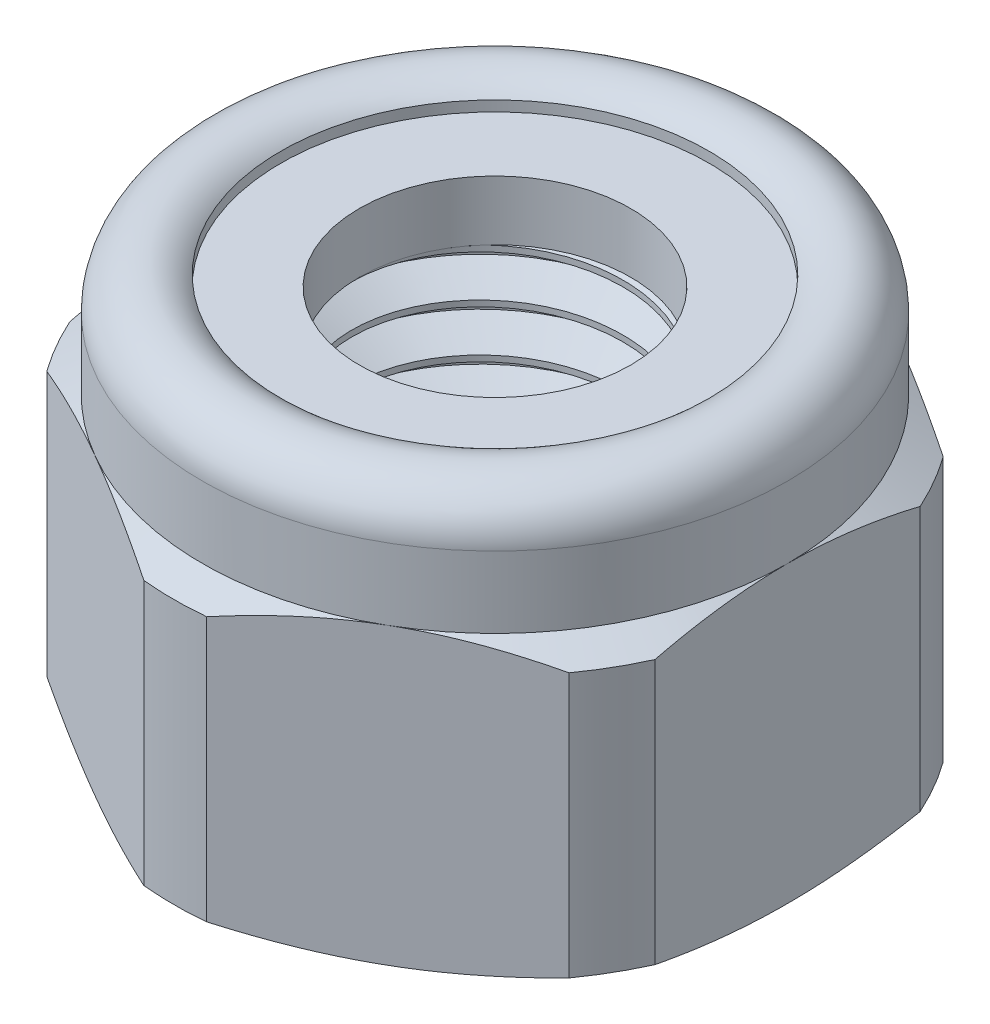
from build123d import *

# Parameters (mm, degrees)
BOSS_EXTRUDE1_DEPTH      = 3.9751
BOSS_EXTRUDE1_DEPTH_BACK = 3.9751
SKETCH2_R                = 2.585793431
SKETCH4_W                = 1.494753284
SKETCH4_H                = 1.134825881
SKETCH11_OUTSIDE_W       = 16.91
SKETCH11_OUTSIDE_H       = 18.636
SKETCH11_OUTSIDE_R       = 6.1214
CUT_EXTRUDE1_DEPTH       = 12.650534115
SKETCH6_W                = 3.175
SKETCH6_H                = 6.36016
CUT_SWEEP1_PITCH         = 0.907142857
CUT_SWEEP1_HEIGHT        = 7.9502
CUT_SWEEP1_RADIUS        = 3.175
CUT_SWEEP1_START_ANGLE   = 90
SKETCH10_R               = 3.220793431
BOSS_EXTRUDE2_DEPTH      = 6.36016


with BuildPart() as part:
    # Sketch2 → Boss-Extrude1 (new, two sides: drawn at the far end of the back side and taken through both)
    with BuildSketch(Plane(origin=(0, 0, 0), x_dir=(1, 0, 0), z_dir=(0, 1, 0)).offset(-BOSS_EXTRUDE1_DEPTH_BACK)):
        Polygon((0, 6.437801912), (-5.5753, 3.218900956), (-5.5753, -3.218900956), (0, -6.437801912), (5.5753, -3.218900956), (5.5753, 3.218900956), align=None)
        with Locations(Location((0, 0, 0), (0, 0, 270))):
            Circle(SKETCH2_R, mode=Mode.SUBTRACT)
    extrude(amount=BOSS_EXTRUDE1_DEPTH + BOSS_EXTRUDE1_DEPTH_BACK)

    # Sketch3 → Cut-Revolve2 (revolve, cut)
    with BuildSketch(Plane(origin=(0, 0, 0), x_dir=(0, 0, -1), z_dir=(1, 0, 0)), mode=Mode.PRIVATE) as cut_revolve2_sk:
        with BuildLine():
            Line((6.437801912, 1.7399), (6.437801912, 4.9751))
            Line((6.437801912, 4.9751), (2.585793431, 4.9751))
            Line((2.585793431, 4.9751), (2.585793431, 2.38506))
            Line((2.585793431, 2.38506), (4.080546715, 2.38506))
            Line((4.080546715, 2.38506), (4.080546715, 3.718640881))
            ThreePointArc((4.080546715, 3.718640881), (5.034773785, 3.908448447), (5.5753, 3.099493798))
            Line((5.5753, 3.099493798), (5.5753, 1.7399))
            Line((5.5753, 1.7399), (6.437801912, 1.23371655))
            Line((6.437801912, 1.23371655), (6.437801912, 1.7399))
        make_face()
        Polygon((5.352288, -3.9751), (6.437801912, -3.46891655), (6.437801912, -3.9751), align=None)
        Polygon((2.585793431, -3.9751), (2.585793431, -3.3401), (3.220793431, -3.9751), align=None)
    revolve(cut_revolve2_sk.sketch.rotate(Axis((0, -3.9751, 0), (0, 1, 0)), 270), axis=Axis((0, -3.9751, 0), (0, 1, 0)), mode=Mode.SUBTRACT)

    # Sketch11 outside → Cut-Extrude1 (cut, through all)
    with BuildSketch(Plane.XZ.offset(3.9751)):
        Rectangle(SKETCH11_OUTSIDE_W, SKETCH11_OUTSIDE_H)
        Circle(SKETCH11_OUTSIDE_R, mode=Mode.SUBTRACT)
    extrude(amount=-CUT_EXTRUDE1_DEPTH, mode=Mode.SUBTRACT)

    # Sketch10 → Boss-Extrude2 (add)
    with BuildSketch(Plane.XZ.offset(3.9751)):
        Circle(SKETCH10_R)
    extrude(amount=-BOSS_EXTRUDE2_DEPTH)


with BuildPart() as body_2:
    # Sketch4 → Revolve1 (revolve)
    with BuildSketch(Plane(origin=(0, 0, 0), x_dir=(0, 0, -1), z_dir=(1, 0, 0)), mode=Mode.PRIVATE) as revolve1_sk:
        with Locations((-3.333170073, 2.952472941)):
            Rectangle(SKETCH4_W, SKETCH4_H)
    revolve(revolve1_sk.sketch.rotate(Axis((0, -3.9751, 0), (0, 1, 0)), 90), axis=Axis((0, -3.9751, 0), (0, 1, 0)))


with BuildPart() as body_3:
    # Sketch6 → Revolve2 (revolve)
    with BuildSketch(Plane.XY, mode=Mode.PRIVATE) as revolve2_sk:
        with Locations((1.5875, -0.79502)):
            Rectangle(SKETCH6_W, SKETCH6_H)
    revolve(revolve2_sk.sketch.rotate(Axis((0, -3.9751, 0), (0, 1, 0)), 90), axis=Axis((0, -3.9751, 0), (0, 1, 0)))

    # Cut-Sweep1: sweep along a helix
    with BuildLine() as cut_sweep1_path:
        add(Helix(CUT_SWEEP1_PITCH, CUT_SWEEP1_HEIGHT, CUT_SWEEP1_RADIUS, center=(0, -3.9751, 0), direction=(0, 1, 0), mode=Mode.PRIVATE).rotate(Axis((0, -3.9751, 0), (0, 1, 0)), CUT_SWEEP1_START_ANGLE))
    # Sketch8 → Cut-Sweep1 (sweep, cut)
    with BuildSketch(Plane.XY):
        Polygon((2.585793431, -4.315278571), (2.585793431, -4.428671429), (3.224100547, -4.797198214), (3.273201095, -3.918403571), align=None)
    sweep(path=cut_sweep1_path.line, is_frenet=True, mode=Mode.SUBTRACT)

    # Sketch9 → Revolve3 (revolve)
    with BuildSketch(Plane.XY, mode=Mode.PRIVATE) as revolve3_sk:
        Polygon((0, -0.8001), (0, -3.9751), (3.175, -3.9751), (3.81, -3.9751), (0, -0.1651), align=None)
    revolve(revolve3_sk.sketch.rotate(Axis((0, -0.8001, 0), (0, -1, 0)), 54.39917973), axis=Axis((0, -0.8001, 0), (0, -1, 0)))


with BuildPart() as part_1:
    add(part.part)

    # Combine1: cut body 3
    add(body_3.part, mode=Mode.SUBTRACT)


solid = Compound([body_2.part, part_1.part])
